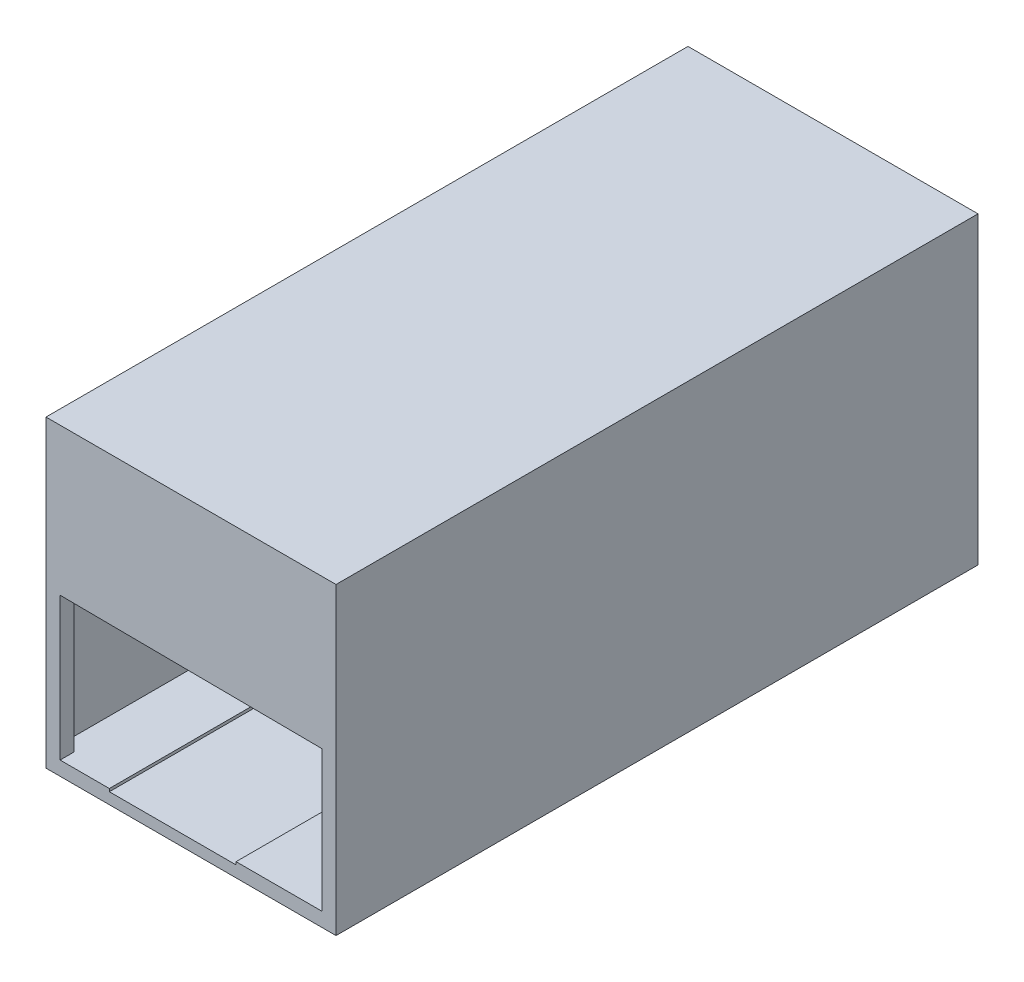
from build123d import *

# Parameters (mm, degrees)
SKETCH_1_W          = 103
SKETCH_1_H          = 108
EXTRUDE_1_DEPTH     = 228
CUT_EXTRUDE_START   = -5
CUT_EXTRUDE_1_DEPTH = 218
SKETCH_3_R          = 8
CUT_EXTRUDE_2_DEPTH = 363
CUT_EXTRUDE_3_REACH = 257.947
SKETCH_4_R          = 23.5
CUT_EXTRUDE_5_DEPTH = 444
CUT_EXTRUDE_6_DEPTH = 1


with BuildPart() as part:
    # 草图1 → 凸台-拉伸1 (new body)
    with BuildSketch(Plane.XY):
        Rectangle(SKETCH_1_W, SKETCH_1_H)
    extrude(amount=-EXTRUDE_1_DEPTH)

    # 草图2 → 切除-拉伸1 (cut)
    with BuildSketch(Plane.XY.offset(CUT_EXTRUDE_START)):
        Polygon((-51.3, -49), (51.3, -49), (51.3, 49), (-0.803988537, 49), (-51.3, 49), align=None)
    extrude(amount=-CUT_EXTRUDE_1_DEPTH, mode=Mode.SUBTRACT)

    # 草图3 → 切除-拉伸2 (cut)
    with BuildSketch(Plane.XY):
        with Locations((21.4, -24.37)):
            Circle(SKETCH_3_R)
    extrude(amount=-CUT_EXTRUDE_2_DEPTH, mode=Mode.SUBTRACT)

    # 草图4 → 切除-拉伸3 (cut, up to next)
    with BuildSketch(Plane.ZY.offset(51.5), mode=Mode.PRIVATE) as cut_extrude_3_sk1:
        with Locations((-114, 5.82)):
            Circle(SKETCH_4_R)
    cut_extrude_3_tool1 = extrude(cut_extrude_3_sk1.sketch, amount=-CUT_EXTRUDE_3_REACH, mode=Mode.PRIVATE) & part.part
    add(cut_extrude_3_tool1.solids().sort_by_distance((-51.5, 5.82, -114))[0], mode=Mode.SUBTRACT)

    # 草图8 → 切除-拉伸5 (cut)
    with BuildSketch(Plane.XY):
        Polygon((0, -49), (46.5, -49), (46.5, 1), (-46.5, 1.708475641), (-46.5, -49), align=None)
    extrude(amount=-CUT_EXTRUDE_5_DEPTH, mode=Mode.SUBTRACT)

    # 草图9 → 切除-拉伸6 (cut)
    with BuildSketch(Plane(origin=(0, -49, 0), x_dir=(1, 0, 0), z_dir=(0, 1, 0))):
        Polygon((-29, 228), (11, 228), (16, 228), (16, 0), (-29, 0), align=None)
    extrude(amount=-CUT_EXTRUDE_6_DEPTH, mode=Mode.SUBTRACT)


solid = part.part
